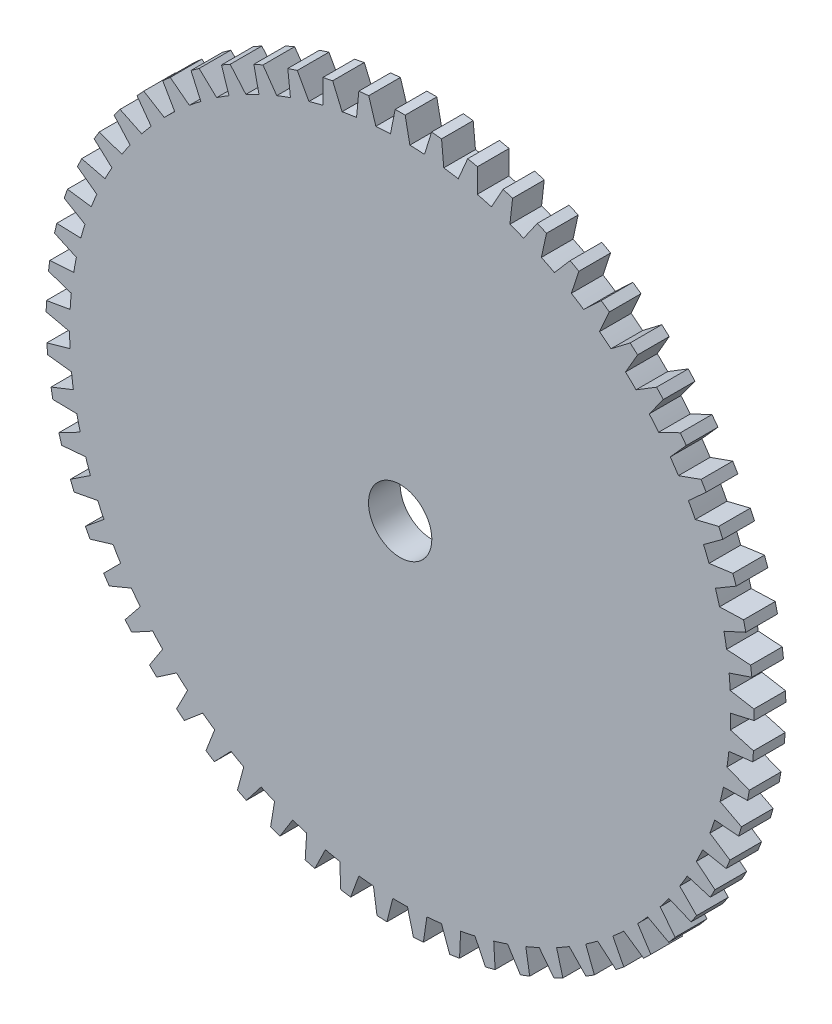
from build123d import *

# Parameters (mm, degrees)
SKETCH1_R           = 33.148778
BOSS_EXTRUDE1_DEPTH = 3.175
SKETCH2_R           = 3.175
CUT_EXTRUDE1_DEPTH  = 3.175
BOSS_EXTRUDE2_DEPTH = 3.175
CIRPATTERN4_COUNT   = 61


with BuildPart() as part:
    # Sketch1 → Boss-Extrude1 (new body)
    with BuildSketch(Plane.XY):
        Circle(SKETCH1_R)
    extrude(amount=BOSS_EXTRUDE1_DEPTH)

    # Sketch2 → Cut-Extrude1 (cut)
    with BuildSketch(Plane.XY.offset(3.175)):
        Circle(SKETCH2_R)
    extrude(amount=-CUT_EXTRUDE1_DEPTH, mode=Mode.SUBTRACT)

    # Sketch3 → Boss-Extrude2 (add)
    with BuildSketch(Plane.XY.offset(3.175)):
        Polygon((-1, 33), (1, 33), (0.5, 35.5), (-0.5, 35.5), align=None)
    boss_extrude2 = extrude(amount=-BOSS_EXTRUDE2_DEPTH)

    # CirPattern4: Boss-Extrude2 ×61 about axis
    cirpattern4_axis = Axis((0, 0, 0), (0, 0, 1))
    for i in range(1, CIRPATTERN4_COUNT):
        add(boss_extrude2.rotate(cirpattern4_axis, i * 360 / CIRPATTERN4_COUNT))


solid = part.part
